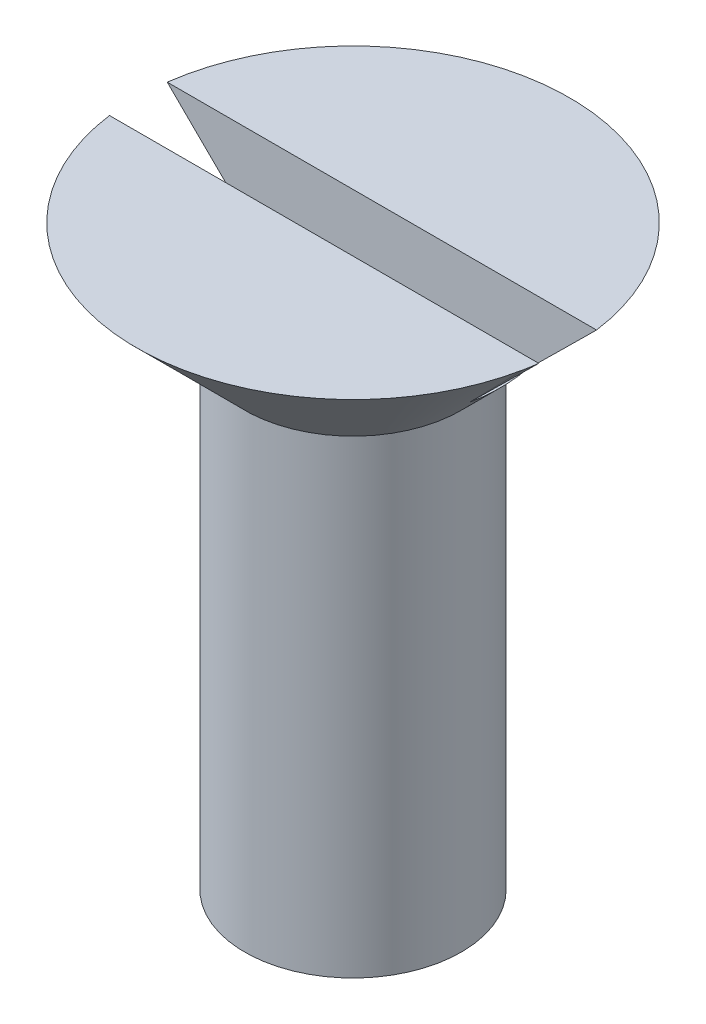
from build123d import *

# Parameters (mm, degrees)
SKETCH2_W          = 16.625644466
SKETCH2_H          = 1.6
CUT_EXTRUDE1_DEPTH = 1.9


with BuildPart() as part:
    # Sketch1 → Revolve1 (revolve)
    with BuildSketch(Plane.XY, mode=Mode.PRIVATE) as revolve1_sk:
        Polygon((0, 0), (3, 0), (3, 13), (6, 16), (0, 16), align=None)
    revolve(revolve1_sk.sketch.rotate(Axis((0, 0, 0), (0, 1, 0)), 90), axis=Axis((0, 0, 0), (0, 1, 0)))

    # Sketch2 → Cut-Extrude1 (cut)
    with BuildSketch(Plane(origin=(0, 16, 0), x_dir=(1, 0, 0), z_dir=(0, 1, 0))):
        Rectangle(SKETCH2_W, SKETCH2_H)
    extrude(amount=-CUT_EXTRUDE1_DEPTH, mode=Mode.SUBTRACT)


solid = part.part
